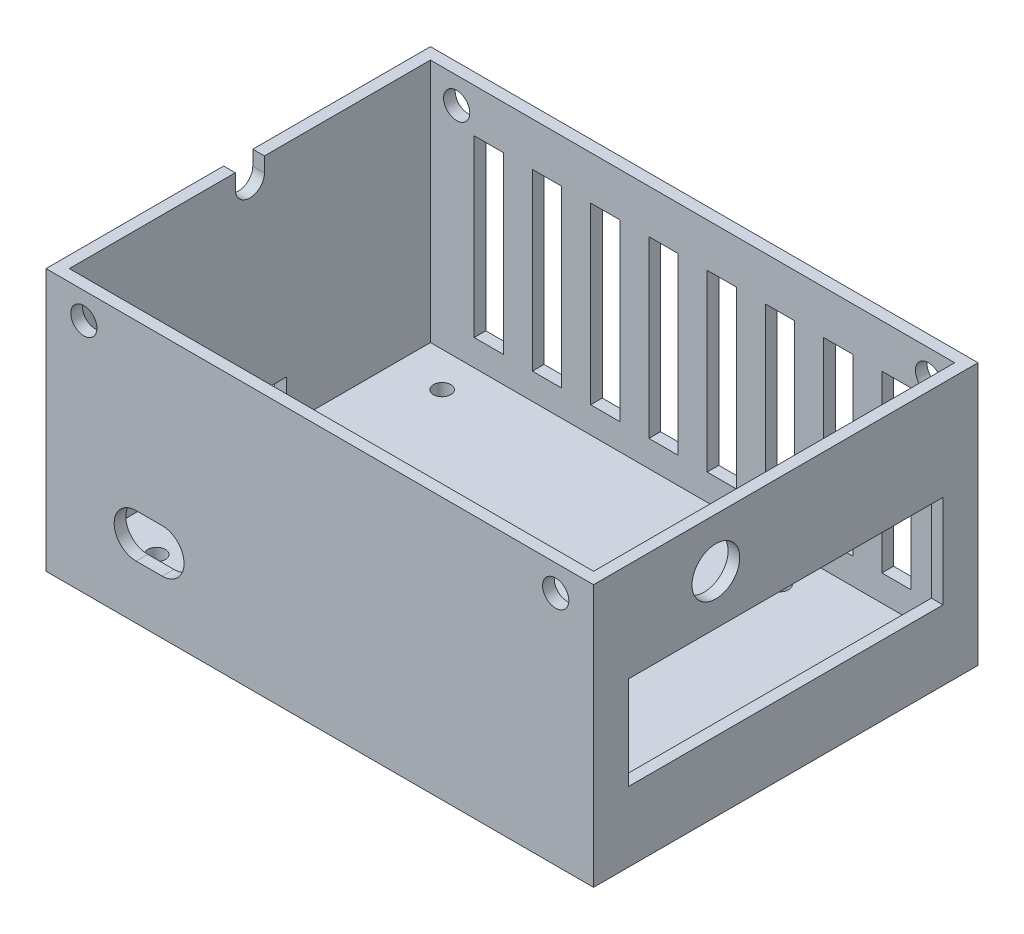
from build123d import *

# Parameters (mm, degrees)
SKETCH1_W           = 90
SKETCH1_H           = 62
BOSS_EXTRUDE1_DEPTH = 3
CUT_EXTRUDE1_REACH  = 56.727
SKETCH2_R           = 1.5
SKETCH3_W           = 94
SKETCH3_H           = 66
SKETCH3_W_2         = 90
SKETCH3_H_2         = 62
BOSS_EXTRUDE2_DEPTH = 45
CUT_EXTRUDE2_REACH  = 109.601
SKETCH4_W           = 12.5
SKETCH4_H           = 2.5
CUT_EXTRUDE3_REACH  = 93.269
CUT_EXTRUDE4_REACH  = 109.601
SKETCH6_W           = 54
SKETCH6_H           = 16
CUT_EXTRUDE5_REACH  = 111.316
SKETCH7_R           = 4.1
SKETCH8_R           = 2.25
CUT_EXTRUDE6_DEPTH  = 93.682252886
CUT_EXTRUDE8_REACH  = 94.682
SKETCH10_W          = 5
SKETCH10_H          = 30
CUT_EXTRUDE9_REACH  = 111.316
CUT_EXTRUDE10_REACH = 74.959
SKETCH12_R          = 2.25


with BuildPart() as part:
    # Sketch1 → Boss-Extrude1 (new body)
    with BuildSketch(Plane(origin=(0, 0, 0), x_dir=(1, 0, 0), z_dir=(0, 1, 0))):
        Rectangle(SKETCH1_W, SKETCH1_H)
    extrude(amount=BOSS_EXTRUDE1_DEPTH)

    # Sketch2 → Cut-Extrude1 (cut, up to next)
    with BuildSketch(Plane(origin=(0, 3, 0), x_dir=(1, 0, 0), z_dir=(0, 1, 0)), mode=Mode.PRIVATE) as cut_extrude1_sk1:
        with Locations(Location((-37, -24, 0), (0, 0, 270))):
            Circle(SKETCH2_R)
    cut_extrude1_tool1 = extrude(cut_extrude1_sk1.sketch, amount=-CUT_EXTRUDE1_REACH, mode=Mode.PRIVATE) & part.part
    # Sketch2 → Cut-Extrude1 (cut, up to next)
    with BuildSketch(Plane(origin=(0, 3, 0), x_dir=(1, 0, 0), z_dir=(0, 1, 0)), mode=Mode.PRIVATE) as cut_extrude1_sk2:
        with Locations(Location((21, -24, 0), (0, 0, 270))):
            Circle(SKETCH2_R)
    cut_extrude1_tool2 = extrude(cut_extrude1_sk2.sketch, amount=-CUT_EXTRUDE1_REACH, mode=Mode.PRIVATE) & part.part
    # Sketch2 → Cut-Extrude1 (cut, up to next)
    with BuildSketch(Plane(origin=(0, 3, 0), x_dir=(1, 0, 0), z_dir=(0, 1, 0)), mode=Mode.PRIVATE) as cut_extrude1_sk3:
        with Locations(Location((21, 25, 0), (0, 0, 270))):
            Circle(SKETCH2_R)
    cut_extrude1_tool3 = extrude(cut_extrude1_sk3.sketch, amount=-CUT_EXTRUDE1_REACH, mode=Mode.PRIVATE) & part.part
    # Sketch2 → Cut-Extrude1 (cut, up to next)
    with BuildSketch(Plane(origin=(0, 3, 0), x_dir=(1, 0, 0), z_dir=(0, 1, 0)), mode=Mode.PRIVATE) as cut_extrude1_sk4:
        with Locations(Location((-37, 25, 0), (0, 0, 270))):
            Circle(SKETCH2_R)
    cut_extrude1_tool4 = extrude(cut_extrude1_sk4.sketch, amount=-CUT_EXTRUDE1_REACH, mode=Mode.PRIVATE) & part.part
    add(cut_extrude1_tool1.solids().sort_by_distance((-37, 3, 24))[0], mode=Mode.SUBTRACT)
    add(cut_extrude1_tool2.solids().sort_by_distance((21, 3, 24))[0], mode=Mode.SUBTRACT)
    add(cut_extrude1_tool3.solids().sort_by_distance((21, 3, -25))[0], mode=Mode.SUBTRACT)
    add(cut_extrude1_tool4.solids().sort_by_distance((-37, 3, -25))[0], mode=Mode.SUBTRACT)

    # Sketch3 → Boss-Extrude2 (add)
    with BuildSketch(Plane(origin=(0, 0, 0), x_dir=(1, 0, 0), z_dir=(0, 1, 0))):
        Rectangle(SKETCH3_W, SKETCH3_H)
        Rectangle(SKETCH3_W_2, SKETCH3_H_2, mode=Mode.SUBTRACT)
    extrude(amount=BOSS_EXTRUDE2_DEPTH)

    # Sketch4 → Cut-Extrude2 (cut, up to next)
    with BuildSketch(Plane(origin=(-45, 0, 0), x_dir=(0, 0, -1), z_dir=(1, 0, 0)), mode=Mode.PRIVATE) as cut_extrude2_sk1:
        with Locations((0, 9)):
            Rectangle(SKETCH4_W, SKETCH4_H)
    cut_extrude2_tool1 = extrude(cut_extrude2_sk1.sketch, amount=-CUT_EXTRUDE2_REACH, mode=Mode.PRIVATE) & part.part
    add(cut_extrude2_tool1.solids().sort_by_distance((-45, 9, 0))[0], mode=Mode.SUBTRACT)

    # Sketch5 → Cut-Extrude3 (cut, up to next)
    with BuildSketch(Plane(origin=(0, 0, 31), x_dir=(-1, 0, 0), z_dir=(0, 0, -1)), mode=Mode.PRIVATE) as cut_extrude3_sk1:
        with BuildLine():
            Line((31.55, 9.25), (27.05, 9.25))
            ThreePointArc((27.05, 9.25), (23.3, 13), (27.05, 16.75))
            Line((27.05, 16.75), (31.55, 16.75))
            ThreePointArc((31.55, 16.75), (35.3, 13), (31.55, 9.25))
        make_face()
    cut_extrude3_tool1 = extrude(cut_extrude3_sk1.sketch, amount=-CUT_EXTRUDE3_REACH, mode=Mode.PRIVATE) & part.part
    add(cut_extrude3_tool1.solids().sort_by_distance((-29.3, 13, 31))[0], mode=Mode.SUBTRACT)

    # Sketch6 → Cut-Extrude4 (cut, up to next)
    with BuildSketch(Plane.ZY.offset(-45), mode=Mode.PRIVATE) as cut_extrude4_sk1:
        with Locations((0, 20)):
            Rectangle(SKETCH6_W, SKETCH6_H)
    cut_extrude4_tool1 = extrude(cut_extrude4_sk1.sketch, amount=-CUT_EXTRUDE4_REACH, mode=Mode.PRIVATE) & part.part
    add(cut_extrude4_tool1.solids().sort_by_distance((45, 20, 0))[0], mode=Mode.SUBTRACT)

    # Sketch7 → Cut-Extrude5 (cut, up to next)
    with BuildSketch(Plane(origin=(47, 0, 0), x_dir=(0, 0, -1), z_dir=(1, 0, 0)), mode=Mode.PRIVATE) as cut_extrude5_sk1:
        with Locations((-12, 36.5)):
            Circle(SKETCH7_R)
    cut_extrude5_tool1 = extrude(cut_extrude5_sk1.sketch, amount=-CUT_EXTRUDE5_REACH, mode=Mode.PRIVATE) & part.part
    add(cut_extrude5_tool1.solids().sort_by_distance((47, 36.5, 12))[0], mode=Mode.SUBTRACT)

    # Sketch8 → Cut-Extrude6 (cut, through all)
    with BuildSketch(Plane.XY.offset(33)):
        with Locations((-40.5, 40.5)):
            Circle(SKETCH8_R)
        with Locations(Location((40.5, 40.5, 0), (0, 0, 180))):
            Circle(SKETCH8_R)
    extrude(amount=-CUT_EXTRUDE6_DEPTH, mode=Mode.SUBTRACT)

    # Sketch10 → Cut-Extrude8 (cut, up to next)
    with BuildSketch(Plane(origin=(0, 0, -33), x_dir=(-1, 0, 0), z_dir=(0, 0, -1)), mode=Mode.PRIVATE) as cut_extrude8_sk1:
        with Locations((15, 22.5)):
            Rectangle(SKETCH10_W, SKETCH10_H)
    cut_extrude8_tool1 = extrude(cut_extrude8_sk1.sketch, amount=-CUT_EXTRUDE8_REACH, mode=Mode.PRIVATE) & part.part
    # Sketch10 → Cut-Extrude8 (cut, up to next)
    with BuildSketch(Plane(origin=(0, 0, -33), x_dir=(-1, 0, 0), z_dir=(0, 0, -1)), mode=Mode.PRIVATE) as cut_extrude8_sk2:
        with Locations((5, 22.5)):
            Rectangle(SKETCH10_W, SKETCH10_H)
    cut_extrude8_tool2 = extrude(cut_extrude8_sk2.sketch, amount=-CUT_EXTRUDE8_REACH, mode=Mode.PRIVATE) & part.part
    # Sketch10 → Cut-Extrude8 (cut, up to next)
    with BuildSketch(Plane(origin=(0, 0, -33), x_dir=(-1, 0, 0), z_dir=(0, 0, -1)), mode=Mode.PRIVATE) as cut_extrude8_sk3:
        with Locations((25, 22.5)):
            Rectangle(SKETCH10_W, SKETCH10_H)
    cut_extrude8_tool3 = extrude(cut_extrude8_sk3.sketch, amount=-CUT_EXTRUDE8_REACH, mode=Mode.PRIVATE) & part.part
    # Sketch10 → Cut-Extrude8 (cut, up to next)
    with BuildSketch(Plane(origin=(0, 0, -33), x_dir=(-1, 0, 0), z_dir=(0, 0, -1)), mode=Mode.PRIVATE) as cut_extrude8_sk4:
        with Locations((35, 22.5)):
            Rectangle(SKETCH10_W, SKETCH10_H)
    cut_extrude8_tool4 = extrude(cut_extrude8_sk4.sketch, amount=-CUT_EXTRUDE8_REACH, mode=Mode.PRIVATE) & part.part
    # Sketch10 → Cut-Extrude8 (cut, up to next)
    with BuildSketch(Plane(origin=(0, 0, -33), x_dir=(-1, 0, 0), z_dir=(0, 0, -1)), mode=Mode.PRIVATE) as cut_extrude8_sk5:
        with Locations((-5, 22.5)):
            Rectangle(SKETCH10_W, SKETCH10_H)
    cut_extrude8_tool5 = extrude(cut_extrude8_sk5.sketch, amount=-CUT_EXTRUDE8_REACH, mode=Mode.PRIVATE) & part.part
    # Sketch10 → Cut-Extrude8 (cut, up to next)
    with BuildSketch(Plane(origin=(0, 0, -33), x_dir=(-1, 0, 0), z_dir=(0, 0, -1)), mode=Mode.PRIVATE) as cut_extrude8_sk6:
        with Locations((-15, 22.5)):
            Rectangle(SKETCH10_W, SKETCH10_H)
    cut_extrude8_tool6 = extrude(cut_extrude8_sk6.sketch, amount=-CUT_EXTRUDE8_REACH, mode=Mode.PRIVATE) & part.part
    # Sketch10 → Cut-Extrude8 (cut, up to next)
    with BuildSketch(Plane(origin=(0, 0, -33), x_dir=(-1, 0, 0), z_dir=(0, 0, -1)), mode=Mode.PRIVATE) as cut_extrude8_sk7:
        with Locations((-25, 22.5)):
            Rectangle(SKETCH10_W, SKETCH10_H)
    cut_extrude8_tool7 = extrude(cut_extrude8_sk7.sketch, amount=-CUT_EXTRUDE8_REACH, mode=Mode.PRIVATE) & part.part
    # Sketch10 → Cut-Extrude8 (cut, up to next)
    with BuildSketch(Plane(origin=(0, 0, -33), x_dir=(-1, 0, 0), z_dir=(0, 0, -1)), mode=Mode.PRIVATE) as cut_extrude8_sk8:
        with Locations((-35, 22.5)):
            Rectangle(SKETCH10_W, SKETCH10_H)
    cut_extrude8_tool8 = extrude(cut_extrude8_sk8.sketch, amount=-CUT_EXTRUDE8_REACH, mode=Mode.PRIVATE) & part.part
    add(cut_extrude8_tool1.solids().sort_by_distance((-15, 22.5, -33))[0], mode=Mode.SUBTRACT)
    add(cut_extrude8_tool2.solids().sort_by_distance((-5, 22.5, -33))[0], mode=Mode.SUBTRACT)
    add(cut_extrude8_tool3.solids().sort_by_distance((-25, 22.5, -33))[0], mode=Mode.SUBTRACT)
    add(cut_extrude8_tool4.solids().sort_by_distance((-35, 22.5, -33))[0], mode=Mode.SUBTRACT)
    add(cut_extrude8_tool5.solids().sort_by_distance((5, 22.5, -33))[0], mode=Mode.SUBTRACT)
    add(cut_extrude8_tool6.solids().sort_by_distance((15, 22.5, -33))[0], mode=Mode.SUBTRACT)
    add(cut_extrude8_tool7.solids().sort_by_distance((25, 22.5, -33))[0], mode=Mode.SUBTRACT)
    add(cut_extrude8_tool8.solids().sort_by_distance((35, 22.5, -33))[0], mode=Mode.SUBTRACT)

    # Sketch11 → Cut-Extrude9 (cut, up to next)
    with BuildSketch(Plane.ZY.offset(47), mode=Mode.PRIVATE) as cut_extrude9_sk1:
        with BuildLine():
            Line((2.5, 47.5), (2.5, 42.5))
            ThreePointArc((2.5, 42.5), (0, 40), (-2.5, 42.5))
            Line((-2.5, 42.5), (-2.5, 47.5))
            ThreePointArc((-2.5, 47.5), (0, 50), (2.5, 47.5))
        make_face()
    cut_extrude9_tool1 = extrude(cut_extrude9_sk1.sketch, amount=-CUT_EXTRUDE9_REACH, mode=Mode.PRIVATE) & part.part
    add(cut_extrude9_tool1.solids().sort_by_distance((-47, 45, 0))[0], mode=Mode.SUBTRACT)

    # Sketch12 → Cut-Extrude10 (cut, up to next)
    with BuildSketch(Plane.XZ, mode=Mode.PRIVATE) as cut_extrude10_sk1:
        with Locations(Location((-40, 0, 0), (0, 0, 270))):
            Circle(SKETCH12_R)
    cut_extrude10_tool1 = extrude(cut_extrude10_sk1.sketch, amount=-CUT_EXTRUDE10_REACH, mode=Mode.PRIVATE) & part.part
    # Sketch12 → Cut-Extrude10 (cut, up to next)
    with BuildSketch(Plane.XZ, mode=Mode.PRIVATE) as cut_extrude10_sk2:
        with Locations(Location((-10, 0, 0), (0, 0, 270))):
            Circle(SKETCH12_R)
    cut_extrude10_tool2 = extrude(cut_extrude10_sk2.sketch, amount=-CUT_EXTRUDE10_REACH, mode=Mode.PRIVATE) & part.part
    add(cut_extrude10_tool1.solids().sort_by_distance((-40, 0, 0))[0], mode=Mode.SUBTRACT)
    add(cut_extrude10_tool2.solids().sort_by_distance((-10, 0, 0))[0], mode=Mode.SUBTRACT)


solid = part.part
